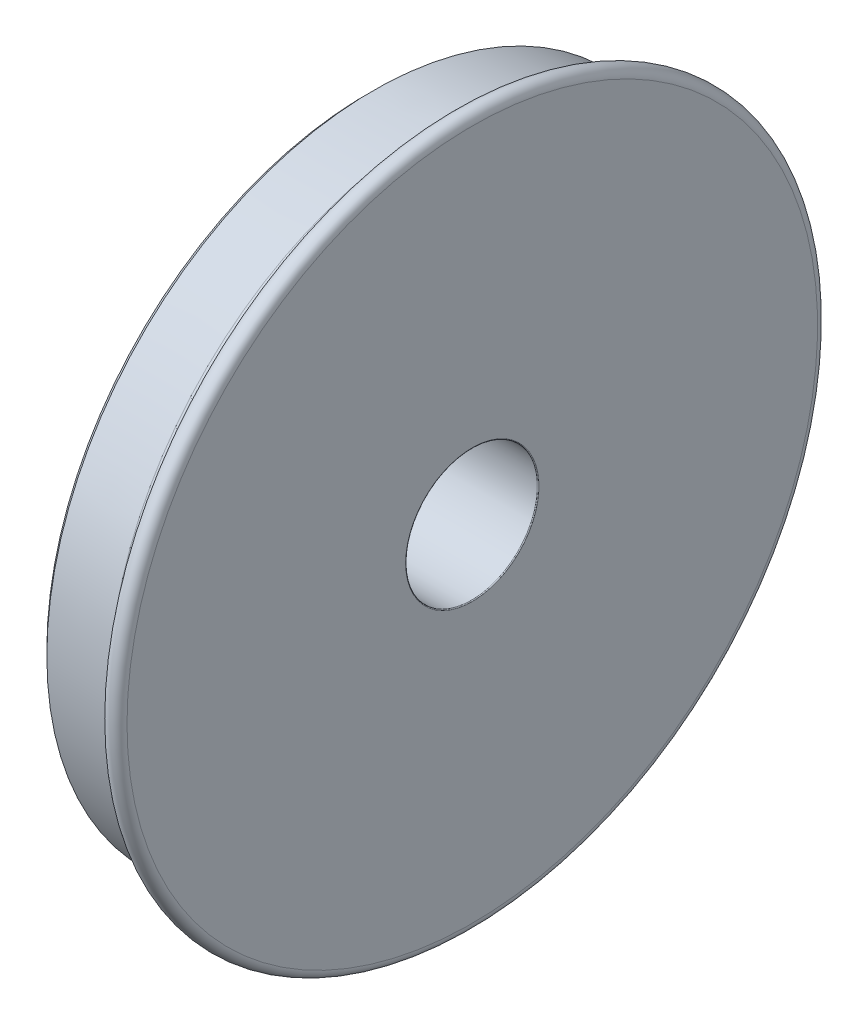
from build123d import *


with BuildPart() as part:
    # Sketch1 → Revolve1 (revolve)
    with BuildSketch(Plane.XY, mode=Mode.PRIVATE) as revolve1_sk:
        with BuildLine():
            Line((0, 20), (34.75, 20))
            ThreePointArc((34.75, 20), (34.926776695, 20.073223305), (35, 20.25))
            Line((35, 20.25), (35, 104.870611348))
            ThreePointArc((35, 104.870611348), (32.419685468, 107.661979883), (29.434472646, 105.308627851))
            Line((29.434472646, 105.308627851), (29.238441703, 104.070937185))
            ThreePointArc((29.238441703, 104.070937185), (27.613100241, 101.108330906), (24.474497484, 99.856155375))
            Line((24.474497484, 99.856155375), (4.957894968, 99.174620597))
            Line((4.957894968, 99.174620597), (3.3, 97.516725629))
            Line((3.3, 97.516725629), (3.3, 79.416725629))
            Line((3.3, 79.416725629), (13.3, 79.416725629))
            Line((13.3, 79.416725629), (13.3, 31.34))
            Line((13.3, 31.34), (0, 31.34))
            Line((0, 31.34), (0, 20))
        make_face()
    revolve(revolve1_sk.sketch.rotate(Axis((-146.164683843, 0, 0), (1, 0, 0)), 90), axis=Axis((-146.164683843, 0, 0), (1, 0, 0)))


solid = part.part
